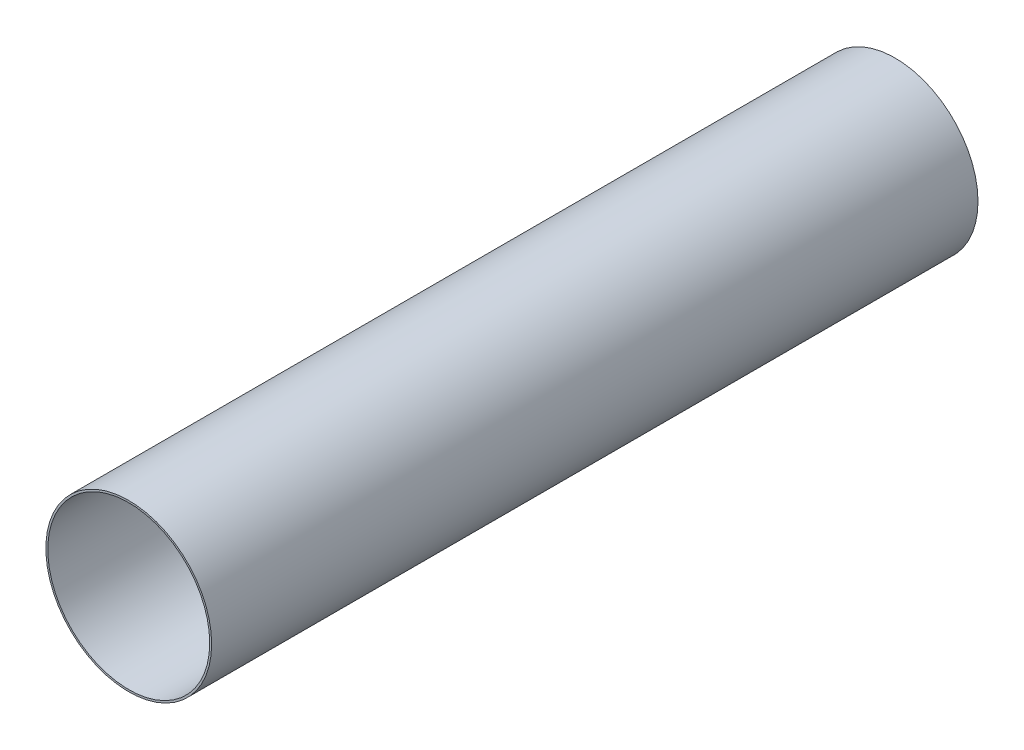
from build123d import *

# Parameters (mm, degrees)
SKETCH1_R           = 82.42808
SKETCH1_R_2         = 80.518
BOSS_EXTRUDE1_DEPTH = 762


with BuildPart() as part:
    # Sketch1 → Boss-Extrude1 (new body)
    with BuildSketch(Plane.XY):
        Circle(SKETCH1_R)
        Circle(SKETCH1_R_2, mode=Mode.SUBTRACT)
    extrude(amount=BOSS_EXTRUDE1_DEPTH)


solid = part.part
